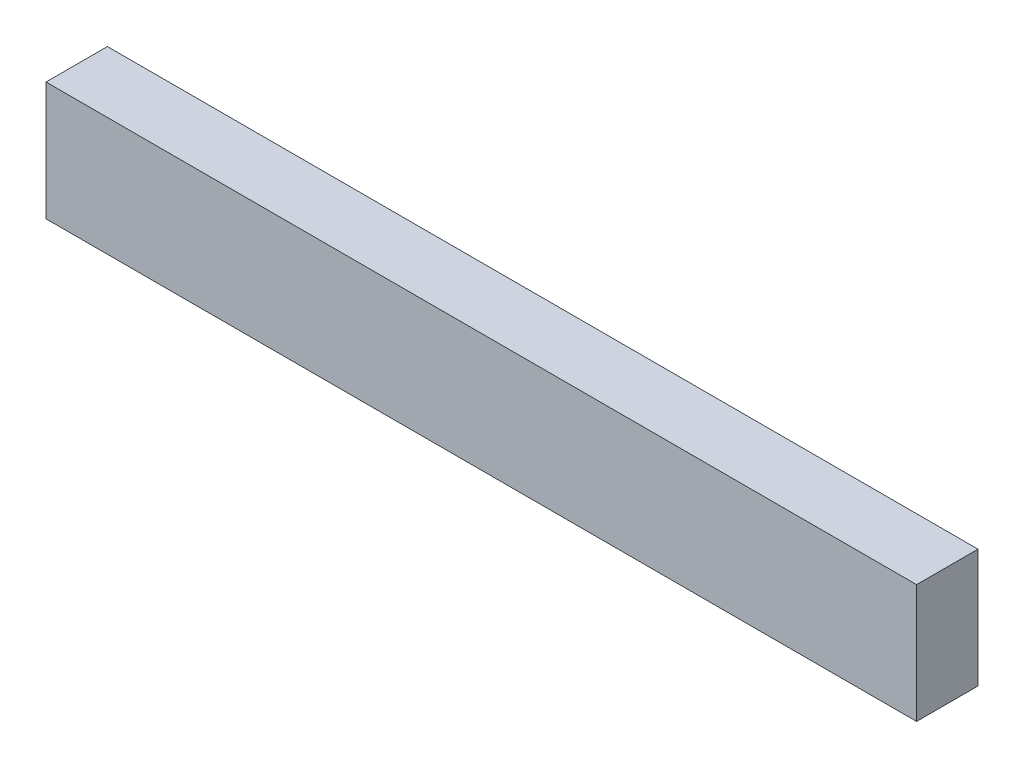
from build123d import *

# Parameters (mm, degrees)
SKETCH1_W           = 90
SKETCH1_H           = 6.35
BOSS_EXTRUDE1_DEPTH = 12.25


with BuildPart() as part:
    # Sketch1 → Boss-Extrude1 (new body)
    with BuildSketch(Plane(origin=(0, 0, 0), x_dir=(1, 0, 0), z_dir=(0, 1, 0))):
        Rectangle(SKETCH1_W, SKETCH1_H)
    extrude(amount=BOSS_EXTRUDE1_DEPTH)


solid = part.part
